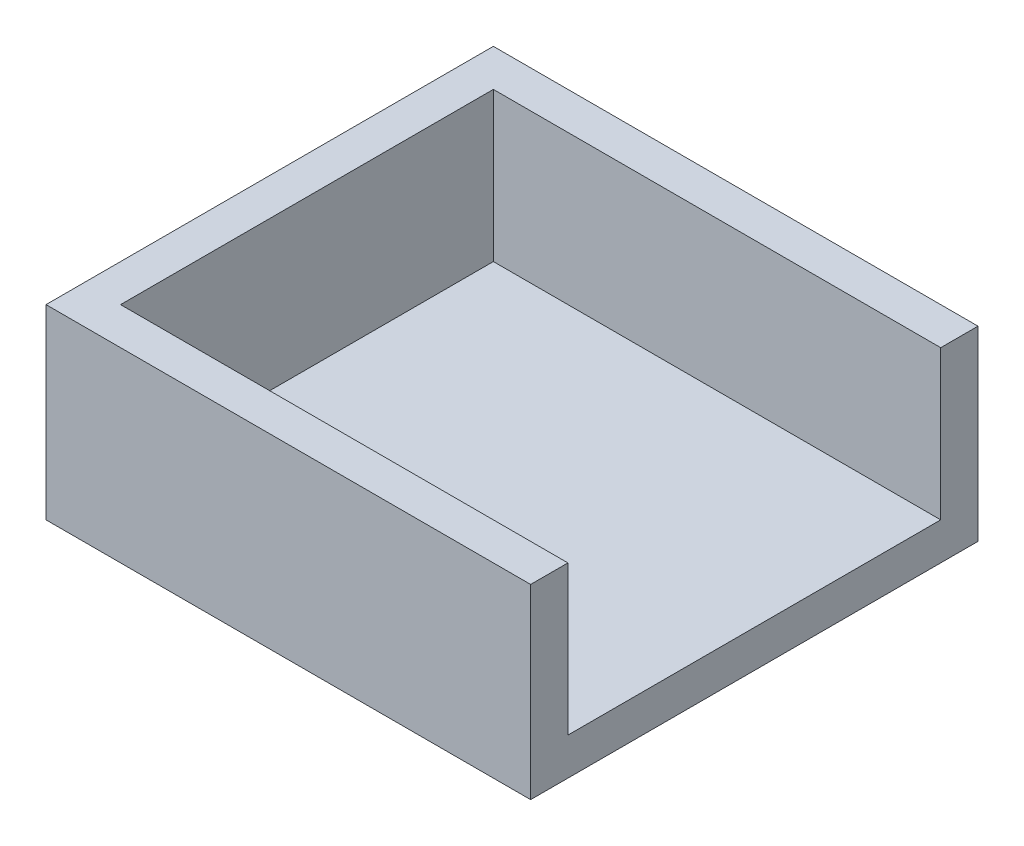
from build123d import *

# Parameters (mm, degrees)
SKETCH1_W           = 165.1
SKETCH1_H           = 152.4
BOSS_EXTRUDE1_DEPTH = 63.5
SKETCH2_W           = 152.4
SKETCH2_H           = 127
CUT_EXTRUDE1_DEPTH  = 50.8


with BuildPart() as part:
    # Sketch1 → Boss-Extrude1 (new body)
    with BuildSketch(Plane(origin=(0, 0, 0), x_dir=(1, 0, 0), z_dir=(0, 1, 0))):
        with Locations((82.55, 76.2)):
            Rectangle(SKETCH1_W, SKETCH1_H)
    extrude(amount=BOSS_EXTRUDE1_DEPTH)

    # Sketch2 → Cut-Extrude1 (cut)
    with BuildSketch(Plane(origin=(0, 63.5, 0), x_dir=(1, 0, 0), z_dir=(0, 1, 0))):
        with Locations((88.9, 76.2)):
            Rectangle(SKETCH2_W, SKETCH2_H)
    extrude(amount=-CUT_EXTRUDE1_DEPTH, mode=Mode.SUBTRACT)


solid = part.part
